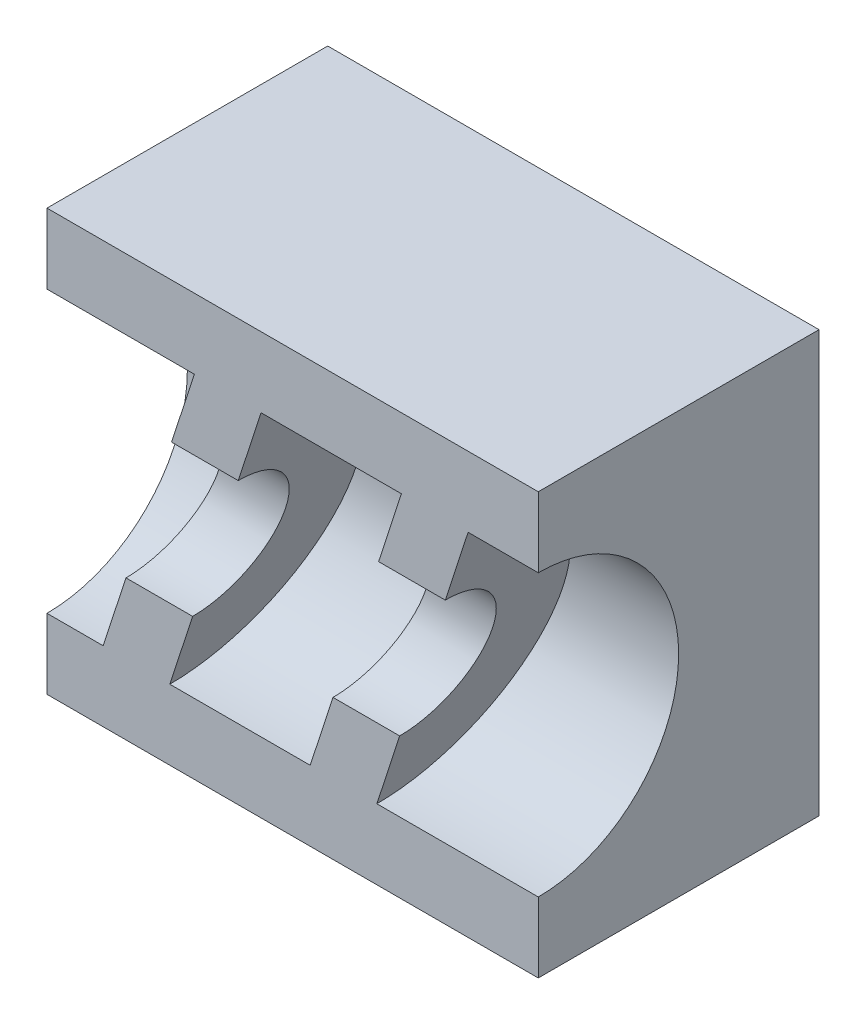
from build123d import *

# Parameters (mm, degrees)
SKETCH_1_W          = 7
SKETCH_1_H          = 6
EXTRUDE_1_DEPTH     = 4
SKETCH_2_R          = 2
CUT_EXTRUDE_1_DEPTH = 11.049875621
EXTRUDE_2_REACH     = 12.05
SKETCH_7_R          = 1
CUT_EXTRUDE_3_DEPTH = 11.049875621


with BuildPart() as part:
    # 草图1 → 凸台-拉伸1 (new body)
    with BuildSketch(Plane.XY):
        with Locations((3.5, 3)):
            Rectangle(SKETCH_1_W, SKETCH_1_H)
    extrude(amount=EXTRUDE_1_DEPTH)

    # 草图2 → 切除-拉伸1 (cut, through all)
    with BuildSketch(Plane.ZY):
        with Locations((4, 3)):
            Circle(SKETCH_2_R)
    extrude(amount=-CUT_EXTRUDE_1_DEPTH, mode=Mode.SUBTRACT)

    # 草图6 → 凸台-拉伸2 (add, up to next)
    with BuildSketch(Plane.XY.offset(4), mode=Mode.PRIVATE) as extrude_2_sk1:
        Polygon((5.05, 5), (6, 5), (4.700321215, 1), (3.750321215, 1), align=None)
    extrude_2_tool1 = extrude(extrude_2_sk1.sketch, amount=-EXTRUDE_2_REACH, mode=Mode.PRIVATE) - part.part
    # 草图6 → 凸台-拉伸2 (add, up to next)
    with BuildSketch(Plane.XY.offset(4), mode=Mode.PRIVATE) as extrude_2_sk2:
        Polygon((2.1, 5), (3.05, 5), (1.750321215, 1), (0.800321215, 1), align=None)
    extrude_2_tool2 = extrude(extrude_2_sk2.sketch, amount=-EXTRUDE_2_REACH, mode=Mode.PRIVATE) - part.part
    add(extrude_2_tool1.solids().sort_by_distance((4.875161, 3, 4))[0])
    add(extrude_2_tool2.solids().sort_by_distance((1.925161, 3, 4))[0])

    # 草图7 → 切除-拉伸3 (cut, through all)
    with BuildSketch(Plane(origin=(7, 0, 0), x_dir=(0, 0, -1), z_dir=(1, 0, 0))):
        with Locations((-4, 3)):
            Circle(SKETCH_7_R)
    extrude(amount=-CUT_EXTRUDE_3_DEPTH, mode=Mode.SUBTRACT)


solid = part.part
